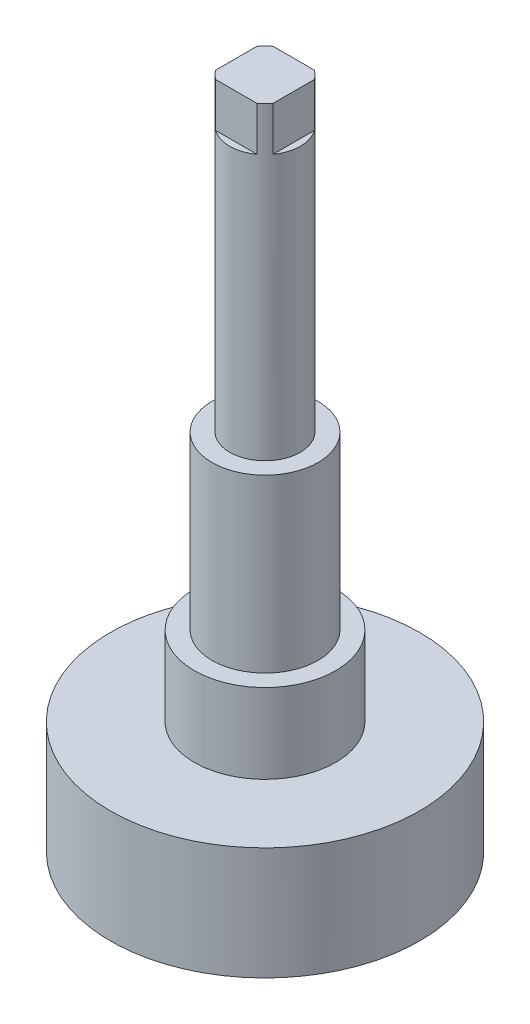
from build123d import *

# Parameters (mm, degrees)
SKETCH1_R           = 5
BOSS_EXTRUDE1_DEPTH = 8
SKETCH2_R           = 17.5
BOSS_EXTRUDE2_DEPTH = 5
BOSS_EXTRUDE3_START = 7.75
SKETCH3_R           = 17.5
SKETCH3_R_2         = 13.5
BOSS_EXTRUDE3_DEPTH = 7.75
SKETCH4_R           = 6
BOSS_EXTRUDE4_DEPTH = 58.4
SKETCH7_R           = 7.998050104
SKETCH7_R_2         = 4
CUT_EXTRUDE1_DEPTH  = 30
SKETCH8_R           = 8
SKETCH8_R_2         = 6
BOSS_EXTRUDE6_DEPTH = 9
BOSS_EXTRUDE7_START = 5
BOSS_EXTRUDE7_DEPTH = 5


with BuildPart() as part:
    # Sketch1 → Boss-Extrude1 (new body)
    with BuildSketch(Plane(origin=(0, 0, 0), x_dir=(1, 0, 0), z_dir=(0, 1, 0))):
        with Locations(Location((0, 0, 0), (0, 0, 270))):
            Circle(SKETCH1_R)
    extrude(amount=-BOSS_EXTRUDE1_DEPTH)

    # Sketch2 → Boss-Extrude2 (add)
    with BuildSketch(Plane(origin=(0, 0, 0), x_dir=(1, 0, 0), z_dir=(0, 1, 0))):
        with Locations(Location((0, 0, 0), (0, 0, 270))):
            Circle(SKETCH2_R)
    extrude(amount=BOSS_EXTRUDE2_DEPTH)

    # Sketch3 → Boss-Extrude3 (add)
    with BuildSketch(Plane.XZ.offset(BOSS_EXTRUDE3_START)):
        with Locations(Location((0, 0, 0), (0, 0, 270))):
            Circle(SKETCH3_R)
        with Locations(Location((0, 0, 0), (0, 0, 270))):
            Circle(SKETCH3_R_2, mode=Mode.SUBTRACT)
    extrude(amount=-BOSS_EXTRUDE3_DEPTH)

    # Sketch4 → Boss-Extrude4 (add)
    with BuildSketch(Plane(origin=(0, 5, 0), x_dir=(1, 0, 0), z_dir=(0, 1, 0))):
        with Locations(Location((0, 0, 0), (0, 0, 270))):
            Circle(SKETCH4_R)
    extrude(amount=BOSS_EXTRUDE4_DEPTH)

    # Sketch7 → Cut-Extrude1 (cut)
    with BuildSketch(Plane(origin=(0, 63.4, 0), x_dir=(1, 0, 0), z_dir=(0, 1, 0))):
        Circle(SKETCH7_R)
        with Locations(Location((0, 0, 0), (0, 0, 270))):
            Circle(SKETCH7_R_2, mode=Mode.SUBTRACT)
    extrude(amount=-CUT_EXTRUDE1_DEPTH, mode=Mode.SUBTRACT)

    # Sketch8 → Boss-Extrude6 (add)
    with BuildSketch(Plane(origin=(0, 5, 0), x_dir=(1, 0, 0), z_dir=(0, 1, 0))):
        with Locations(Location((0, 0, 0), (0, 0, 270))):
            Circle(SKETCH8_R)
        with Locations(Location((0, 0, 0), (0, 0, 270))):
            Circle(SKETCH8_R_2, mode=Mode.SUBTRACT)
    extrude(amount=BOSS_EXTRUDE6_DEPTH)

    # Sketch10 → Boss-Extrude7 (add)
    with BuildSketch(Plane(origin=(0, 63.4, 0), x_dir=(1, 0, 0), z_dir=(0, 1, 0)).offset(BOSS_EXTRUDE7_START)):
        with BuildLine():
            Line((-3.25, 2.331844763), (-3.25, -2.331844763))
            ThreePointArc((-3.25, -2.331844763), (-2.828427125, -2.828427125), (-2.331844763, -3.25))
            Line((-2.331844763, -3.25), (2.331844763, -3.25))
            ThreePointArc((2.331844763, -3.25), (2.828427125, -2.828427125), (3.25, -2.331844763))
            Line((3.25, -2.331844763), (3.25, 2.331844763))
            ThreePointArc((3.25, 2.331844763), (2.828427125, 2.828427125), (2.331844763, 3.25))
            Line((2.331844763, 3.25), (-2.331844763, 3.25))
            ThreePointArc((-2.331844763, 3.25), (-2.828427125, 2.828427125), (-3.25, 2.331844763))
        make_face()
    extrude(amount=-BOSS_EXTRUDE7_DEPTH)


solid = part.part
